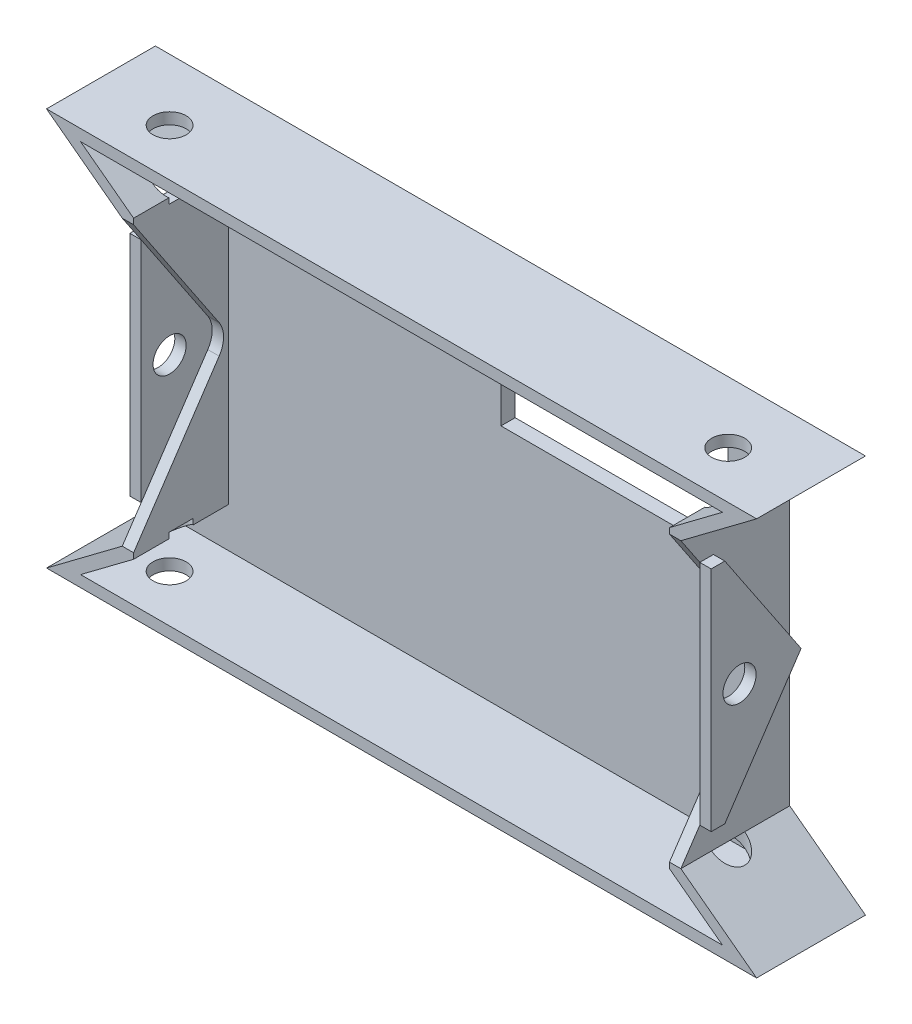
from build123d import *

# Parameters (mm, degrees)
EXTRUDE_1_DEPTH     = 1.5
EXTRUDE_2_DEPTH     = 10
SKETCH_3_R          = 1.75
CUT_EXTRUDE_1_DEPTH = 58.467382053
CUT_EXTRUDE_2_DEPTH = 80.907759323
EXTRUDE_3_DEPTH     = 1.2
EXTRUDE_4_DEPTH     = 1.2
SKETCH_7_R          = 1.75
EXTRUDE_5_DEPTH     = 1.2
EXTRUDE_START       = 1.2
SKETCH_8_R          = 1.75
EXTRUDE_6_DEPTH     = 1.2
SKETCH_9_W          = 24
SKETCH_9_H          = 10
CUT_EXTRUDE_4_DEPTH = 58.467382053


with BuildPart() as part:
    # 草图1 → 凸台-拉伸1 (new body)
    with BuildSketch(Plane.XY):
        Polygon((29.5, 6), (37.5, 0), (-37.5, 0), (-29.5, 6), (-29.5, 36), (-37.5, 42), (37.5, 42), (29.5, 36), align=None)
    extrude(amount=EXTRUDE_1_DEPTH)

    # 草图2 → 凸台-拉伸2 (add)
    with BuildSketch(Plane.XY.offset(1.5)):
        Polygon((29.5, 36), (37.5, 42), (-37.5, 42), (-29.5, 36), (-29.5, 6), (-37.5, 0), (37.5, 0), (29.5, 6), align=None)
        Polygon((28.3, 36.6), (33.9, 40.8), (-33.9, 40.8), (-28.3, 36.6), (-28.3, 5.4), (-33.9, 1.2), (33.9, 1.2), (28.3, 5.4), align=None, mode=Mode.SUBTRACT)
    extrude(amount=EXTRUDE_2_DEPTH)

    # 草图3 → 切除-拉伸1 (cut, through all)
    with BuildSketch(Plane(origin=(0, 42, 0), x_dir=(1, 0, 0), z_dir=(0, 1, 0))):
        with Locations(Location((-29.5, -6.5, 0), (0, 0, 270))):
            Circle(SKETCH_3_R)
        with Locations(Location((29.5, -6.5, 0), (0, 0, 180))):
            Circle(SKETCH_3_R)
    extrude(amount=-CUT_EXTRUDE_1_DEPTH, mode=Mode.SUBTRACT)

    # 草图4 → 切除-拉伸2 (cut, through all)
    with BuildSketch(Plane(origin=(29.5, 0, 0), x_dir=(0, 0, -1), z_dir=(1, 0, 0))):
        with BuildLine():
            Line((-2.466181259, 22.5318851), (-11.5, 36))
            Line((-11.5, 36), (-11.5, 6))
            Line((-11.5, 6), (-2.466181259, 19.4681149))
            ThreePointArc((-2.466181259, 19.4681149), (-2, 21), (-2.466181259, 22.5318851))
        make_face()
    extrude(amount=-CUT_EXTRUDE_2_DEPTH, mode=Mode.SUBTRACT)

    # 草图5 → 凸台-拉伸3 (add)
    with BuildSketch(Plane(origin=(29.5, 0, 0), x_dir=(0, 0, -1), z_dir=(1, 0, 0))):
        Polygon((-4.75, 25.936727957), (-8.25, 31.154720868), (-8.25, 36), (-4.75, 36), align=None)
        Polygon((-4.75, 16.063272043), (-8.25, 10.845279132), (-8.25, 6), (-4.75, 6), align=None)
    extrude(amount=-EXTRUDE_3_DEPTH)

    # 草图6 → 凸台-拉伸4 (add)
    with BuildSketch(Plane.ZY.offset(29.5)):
        Polygon((8.25, 6), (4.75, 6), (4.75, 16.063272043), (8.25, 10.845279132), align=None)
        Polygon((4.75, 25.936727957), (8.25, 31.154720868), (8.25, 36), (4.75, 36), align=None)
    extrude(amount=-EXTRUDE_4_DEPTH)

    # 草图7 → 凸台-拉伸5 (add)
    with BuildSketch(Plane.ZY.offset(29.5)):
        Polygon((9.5, 21), (9.5, 33.018289765), (8.061339847, 33.018289765), (0, 21), (8.061339847, 8.981710235), (9.5, 8.981710235), align=None)
        with Locations((6.5, 21)):
            Circle(SKETCH_7_R, mode=Mode.SUBTRACT)
    extrude(amount=EXTRUDE_5_DEPTH)

    # 草图8 → 凸台-拉伸6 (add)
    with BuildSketch(Plane(origin=(29.5, 0, 0), x_dir=(0, 0, -1), z_dir=(1, 0, 0)).offset(EXTRUDE_START)):
        Polygon((-9.5, 8.981710235), (-9.5, 33.018289765), (-8.061339847, 33.018289765), (0, 21), (-8.061339847, 8.981710235), align=None)
        with Locations(Location((-6.5, 21, 0), (0, 0, 180))):
            Circle(SKETCH_8_R, mode=Mode.SUBTRACT)
    extrude(amount=-EXTRUDE_6_DEPTH)

    # 草图9 → 切除-拉伸4 (cut, through all)
    with BuildSketch(Plane(origin=(0, 0, 0), x_dir=(-1, 0, 0), z_dir=(0, 0, -1))):
        with Locations((-12.5, 32)):
            Rectangle(SKETCH_9_W, SKETCH_9_H)
    extrude(amount=-CUT_EXTRUDE_4_DEPTH, mode=Mode.SUBTRACT)


solid = part.part
